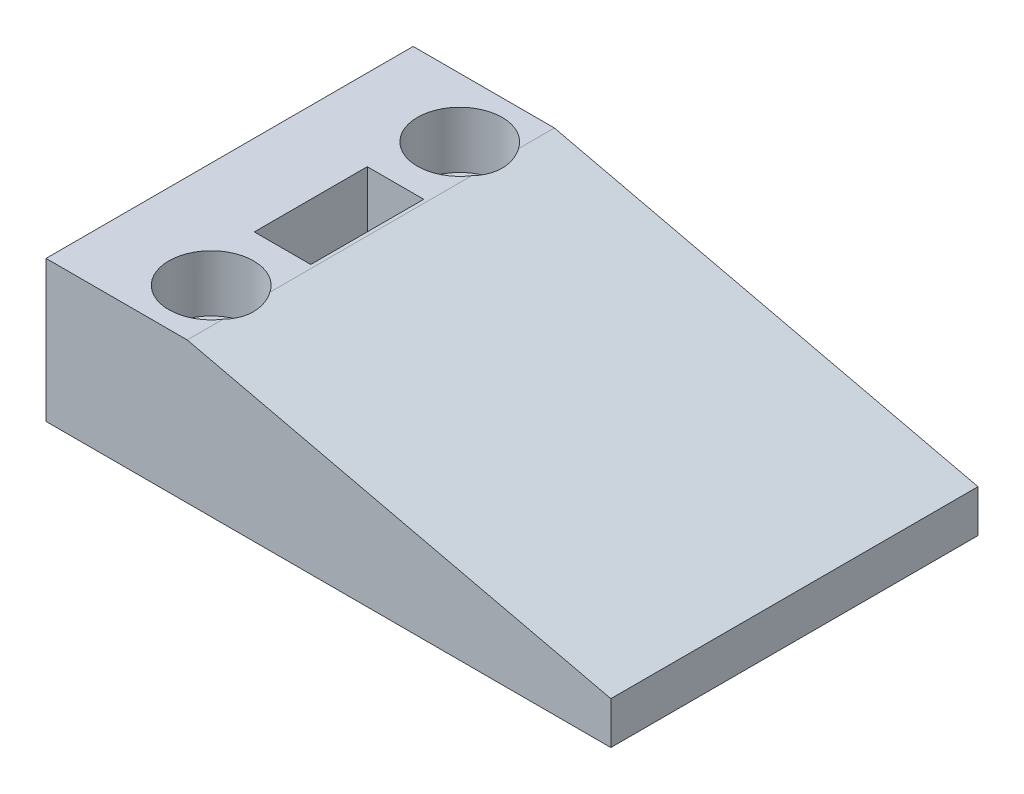
from build123d import *

# Parameters (mm, degrees)
SKETCH1_W           = 40
SKETCH1_H           = 3
SKETCH1_W_2         = 10
SKETCH1_H_2         = 7
BOSS_EXTRUDE1_DEPTH = 26
SKETCH3_R           = 1.725
SKETCH3_W           = 4
SKETCH3_H           = 8
CUT_EXTRUDE1_DEPTH  = 49.744230428
SKETCH4_R           = 3
CUT_EXTRUDE2_DEPTH  = 4


with BuildPart() as part:
    # Sketch1 → Boss-Extrude1 (new body)
    with BuildSketch(Plane.XY):
        with Locations((20, 1.5)):
            Rectangle(SKETCH1_W, SKETCH1_H)
        Polygon((40, 3), (10, 10), (10, 3), align=None)
        with Locations((5, 6.5)):
            Rectangle(SKETCH1_W_2, SKETCH1_H_2)
    extrude(amount=BOSS_EXTRUDE1_DEPTH)

    # Sketch3 → Cut-Extrude1 (cut, through all)
    with BuildSketch(Plane.XZ):
        with Locations(Location((7.5, 21.8, 0), (0, 0, 270))):
            Circle(SKETCH3_R)
        with Locations(Location((7.5, 4.2, 0), (0, 0, 270))):
            Circle(SKETCH3_R)
        with Locations((7.75, 13)):
            Rectangle(SKETCH3_W, SKETCH3_H)
    extrude(amount=-CUT_EXTRUDE1_DEPTH, mode=Mode.SUBTRACT)

    # Sketch4 → Cut-Extrude2 (cut)
    with BuildSketch(Plane(origin=(0, 10, 0), x_dir=(1, 0, 0), z_dir=(0, 1, 0))):
        with Locations(Location((7.5, -4.2, 0), (0, 0, 180))):
            Circle(SKETCH4_R)
        with Locations(Location((7.5, -21.8, 0), (0, 0, 180))):
            Circle(SKETCH4_R)
    extrude(amount=-CUT_EXTRUDE2_DEPTH, mode=Mode.SUBTRACT)


solid = part.part
